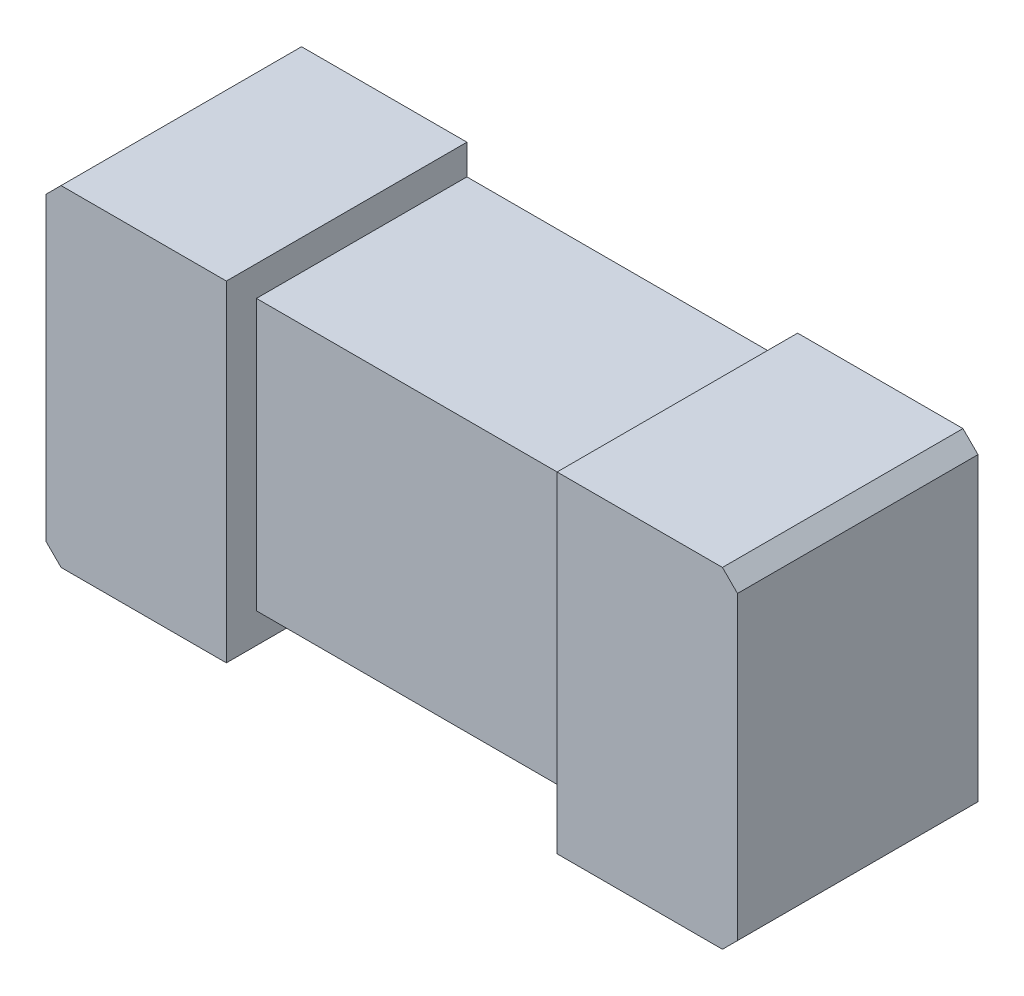
from build123d import *

# Parameters (mm, degrees)
EXTRUDE1_DEPTH     = 0.4
SKETCH1_W          = 0.55
SKETCH1_H          = 0.05
CUT_EXTRUDE1_DEPTH = 1.752495847
SKETCH2_W          = 0.55
SKETCH2_H          = 0.05
CUT_EXTRUDE2_DEPTH = 5


with BuildPart() as part:
    # COMPONENT_OUTLINE → Extrude1 (new body)
    with BuildSketch(Plane.XY):
        Polygon((0.55, 0.275), (-0.55, 0.275), (-0.575, 0.25), (-0.575, -0.25), (-0.55, -0.275), (0.55, -0.275), (0.575, -0.25), (0.575, 0.25), align=None)
    extrude(amount=EXTRUDE1_DEPTH)

    # Sketch1 → Cut-Extrude1 (cut, through all)
    with BuildSketch(Plane.XY.offset(0.4)):
        with Locations((0, 0.25)):
            Rectangle(SKETCH1_W, SKETCH1_H)
        with Locations((0, -0.25)):
            Rectangle(SKETCH1_W, SKETCH1_H)
    extrude(amount=-CUT_EXTRUDE1_DEPTH, mode=Mode.SUBTRACT)

    # Sketch2 → Cut-Extrude2 (cut)
    with BuildSketch(Plane.XZ.offset(0.225)):
        with Locations((0, 0.375)):
            Rectangle(SKETCH2_W, SKETCH2_H)
    extrude(amount=-CUT_EXTRUDE2_DEPTH, mode=Mode.SUBTRACT)


solid = part.part
